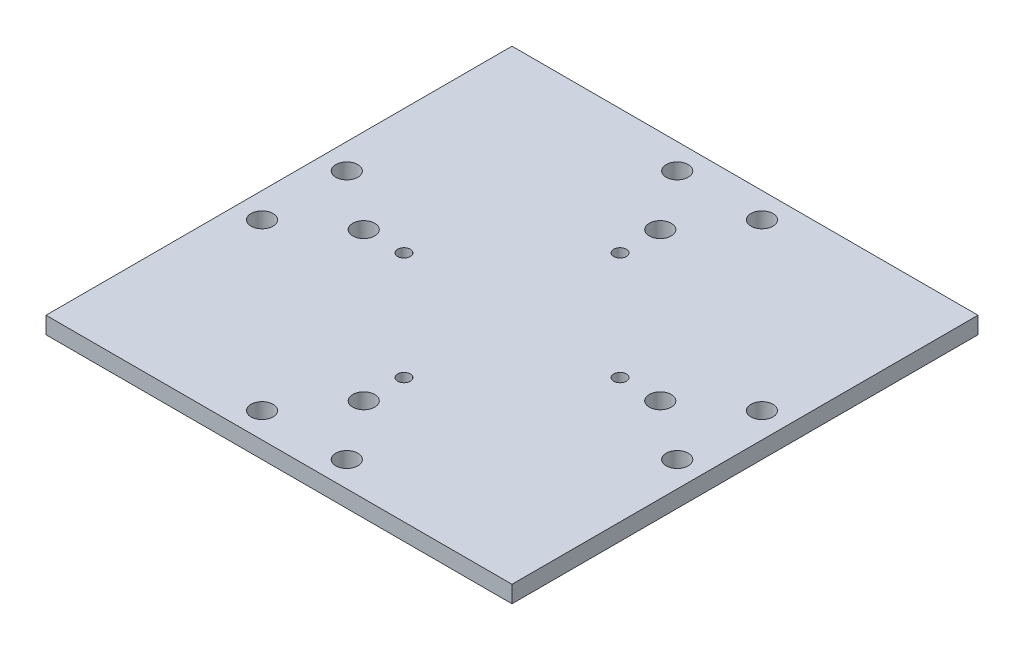
from build123d import *

# Parameters (mm, degrees)
SKETCH_1_W          = 110
SKETCH_1_H          = 110
EXTRUDE_1_DEPTH     = 4
SKETCH_2_R          = 2.6
CUT_EXTRUDE_1_DEPTH = 78.884529914
SKETCH_3_R          = 1.5
CUT_EXTRUDE_2_DEPTH = 78.884529914
SKETCH_4_R          = 2.6
CUT_EXTRUDE_3_DEPTH = 78.884529914


with BuildPart() as part:
    # 草图1 → 凸台-拉伸1 (new body)
    with BuildSketch(Plane(origin=(0, 0, 0), x_dir=(1, 0, 0), z_dir=(0, 1, 0))):
        Rectangle(SKETCH_1_W, SKETCH_1_H)
    extrude(amount=EXTRUDE_1_DEPTH)

    # 草图2 → 切除-拉伸1 (cut, through all)
    with BuildSketch(Plane(origin=(0, 0, 0), x_dir=(1, 0, 0), z_dir=(0, 1, 0))):
        with Locations(Location((0, 35, 0), (0, 0, 270))):
            Circle(SKETCH_2_R)
        with Locations(Location((35, 0, 0), (0, 0, 270))):
            Circle(SKETCH_2_R)
        with Locations(Location((0, -35, 0), (0, 0, 270))):
            Circle(SKETCH_2_R)
        with Locations(Location((-35, 0, 0), (0, 0, 270))):
            Circle(SKETCH_2_R)
    extrude(amount=CUT_EXTRUDE_1_DEPTH, mode=Mode.SUBTRACT)

    # 草图3 → 切除-拉伸2 (cut, through all)
    with BuildSketch(Plane(origin=(0, 4, 0), x_dir=(1, 0, 0), z_dir=(0, 1, 0))):
        with Locations(Location((0, 25.5, 0), (0, 0, 270))):
            Circle(SKETCH_3_R)
        with Locations(Location((25.5, 0, 0), (0, 0, 270))):
            Circle(SKETCH_3_R)
        with Locations(Location((0, -25.5, 0), (0, 0, 270))):
            Circle(SKETCH_3_R)
        with Locations(Location((-25.5, 0, 0), (0, 0, 270))):
            Circle(SKETCH_3_R)
    extrude(amount=-CUT_EXTRUDE_2_DEPTH, mode=Mode.SUBTRACT)

    # 草图4 → 切除-拉伸3 (cut, through all)
    with BuildSketch(Plane(origin=(0, 4, 0), x_dir=(1, 0, 0), z_dir=(0, 1, 0))):
        with Locations(Location((-10, 49, 0), (0, 0, 270))):
            Circle(SKETCH_4_R)
        with Locations(Location((10, 49, 0), (0, 0, 270))):
            Circle(SKETCH_4_R)
        with Locations(Location((49, 10, 0), (0, 0, 270))):
            Circle(SKETCH_4_R)
        with Locations(Location((49, -10, 0), (0, 0, 270))):
            Circle(SKETCH_4_R)
        with Locations(Location((10, -49, 0), (0, 0, 270))):
            Circle(SKETCH_4_R)
        with Locations(Location((-10, -49, 0), (0, 0, 270))):
            Circle(SKETCH_4_R)
        with Locations(Location((-49, -10, 0), (0, 0, 270))):
            Circle(SKETCH_4_R)
        with Locations(Location((-49, 10, 0), (0, 0, 270))):
            Circle(SKETCH_4_R)
    extrude(amount=-CUT_EXTRUDE_3_DEPTH, mode=Mode.SUBTRACT)


solid = part.part
